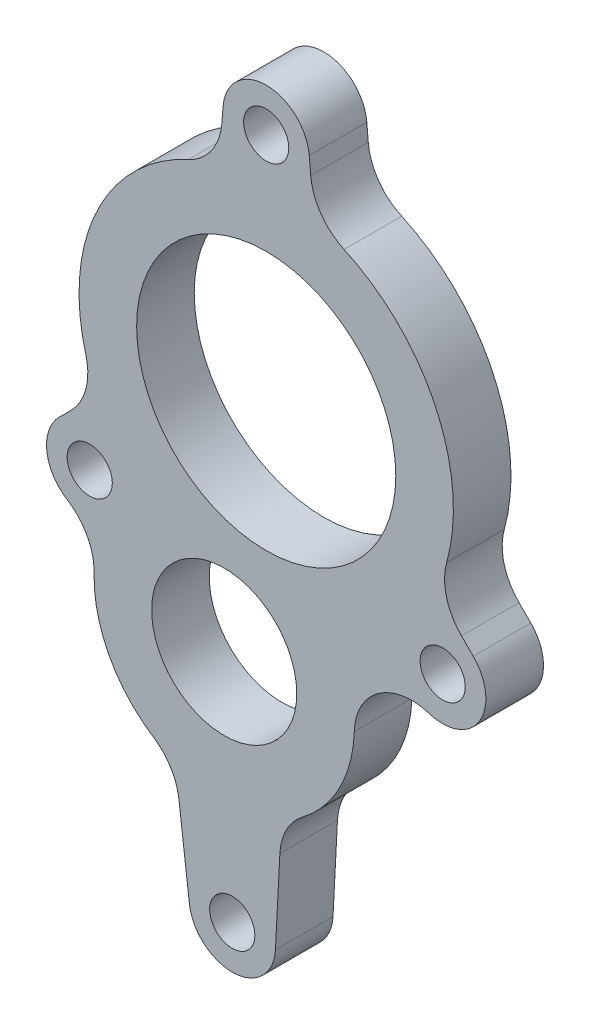
from build123d import *

# Parameters (mm, degrees)
SKETCH1_R               = 2.4892
SKETCH1_R_2             = 14.2875
BOSS_EXTRUDE1_DEPTH     = 3.175
SKETCH48_R              = 2.4892
BOSS_EXTRUDE2_DEPTH     = 3.175
CUT_EXTRUDE1_DEPTH      = 62.473150941
CUT_EXTRUDE1_DEPTH_BACK = 62.473150941
FILLET1_R               = 6.35


with BuildPart() as part:
    # Sketch1 → Boss-Extrude1 (new, symmetric)
    with BuildSketch(Plane.XY):
        with BuildLine():
            Line((-4.74437725, 25.815079225), (-5.256916026, 19.956734205))
            ThreePointArc((-5.256916026, 19.956734205), (-18.703926955, 8.721784377), (-18.666825827, -8.800910167))
            Line((-18.666825827, -8.800910167), (-22.825124901, -12.959209241))
            ThreePointArc((-22.825124901, -12.959209241), (-23.105815516, -19.388081277), (-16.725871077, -20.228016897))
            Line((-16.725871077, -20.228016897), (-11.908664854, -16.854972787))
            ThreePointArc((-11.908664854, -16.854972787), (0, -20.6375), (11.908664854, -16.854972787))
            Line((11.908664854, -16.854972787), (16.725871077, -20.228016897))
            ThreePointArc((16.725871077, -20.228016897), (23.105815516, -19.388081277), (22.825124901, -12.959209241))
            Line((22.825124901, -12.959209241), (18.666825827, -8.800910167))
            ThreePointArc((18.666825827, -8.800910167), (18.703926955, 8.721784377), (5.256916026, 19.956734205))
            Line((5.256916026, 19.956734205), (4.74437725, 25.815079225))
            ThreePointArc((4.74437725, 25.815079225), (0, 30.1625), (-4.74437725, 25.815079225))
        make_face()
        with Locations((0, 25.4)):
            Circle(SKETCH1_R, mode=Mode.SUBTRACT)
        Circle(SKETCH1_R_2, mode=Mode.SUBTRACT)
        with Locations((19.457528855, -16.326805286)):
            Circle(SKETCH1_R, mode=Mode.SUBTRACT)
        with Locations((-19.457528855, -16.326805286)):
            Circle(SKETCH1_R, mode=Mode.SUBTRACT)
    extrude(amount=BOSS_EXTRUDE1_DEPTH, both=True)

    # Sketch48 → Boss-Extrude2 (add, symmetric)
    with BuildSketch(Plane.XY):
        with BuildLine():
            Line((-10.026080704, -39.562360538), (-8.468509885, -52.230199896))
            ThreePointArc((-8.468509885, -52.230199896), (-3.574599444, -56.408575595), (1.014408673, -51.897457398))
            Line((1.014408673, -51.897457398), (1.680248074, -39.151601649))
            ThreePointArc((1.680248074, -39.151601649), (7.424435707, -34.04649077), (9.71079139, -26.709568641))
            ThreePointArc((9.71079139, -26.709568641), (12.397018184, -21.717853667), (18.000475726, -20.860942737))
            ThreePointArc((18.000475726, -20.860942737), (17.339399127, -20.59235715), (16.725871077, -20.228016897))
            Line((16.725871077, -20.228016897), (11.908664854, -16.854972787))
            ThreePointArc((11.908664854, -16.854972787), (9.92035858, -18.09676468), (7.804051349, -19.105056629))
            ThreePointArc((7.804051349, -19.105056629), (5.636733901, -16.241191156), (2.826163363, -14.005193926))
            ThreePointArc((2.826163363, -14.005193926), (-2.481594068, -14.070335715), (-7.446815831, -12.193342045))
            ThreePointArc((-7.446815831, -12.193342045), (-18.919007392, -24.918243731), (-10.026080704, -39.562360538))
        make_face()
        with Locations((-3.741606205, -51.649004712)):
            Circle(SKETCH48_R, mode=Mode.SUBTRACT)
        with BuildLine():
            ThreePointArc((-8.017864397, -19.016315541), (-3.242789938, -18.386223466), (1.028619665, -20.611849695))
            ThreePointArc((1.028619665, -20.611849695), (-6.021827915, -34.14302987), (-8.017864397, -19.016315541))
        make_face(mode=Mode.SUBTRACT)
    extrude(amount=BOSS_EXTRUDE2_DEPTH, both=True)

    # Sketch48<3> → Cut-Extrude1 (cut, two sides: drawn at the far end of the back side and taken through both)
    with BuildSketch(Plane.XY.offset(-CUT_EXTRUDE1_DEPTH_BACK)):
        with BuildLine():
            ThreePointArc((-8.017864397, -19.016315541), (-3.584524765, -20.323818255), (1.028619665, -20.611849695))
            ThreePointArc((1.028619665, -20.611849695), (-3.242789938, -18.386223466), (-8.017864397, -19.016315541))
        make_face()
    extrude(amount=CUT_EXTRUDE1_DEPTH + CUT_EXTRUDE1_DEPTH_BACK, mode=Mode.SUBTRACT)

    # Fillet1
    fillet1_edges = [part.edges().sort_by_distance(p)[0] for p in [
        (18.666825827, -8.800910167, 0),
        (-18.666825827, -8.800910167, 0),
        (-5.256916026, 19.956734205, 0),
        (5.256916026, 19.956734205, 0),
        (1.680248074, -39.151601649, 0),
        (-17.914364977, -20.832363131, 0),
        (-10.026080704, -39.562360538, 0),
    ]]
    fillet(fillet1_edges, radius=FILLET1_R)


solid = part.part
